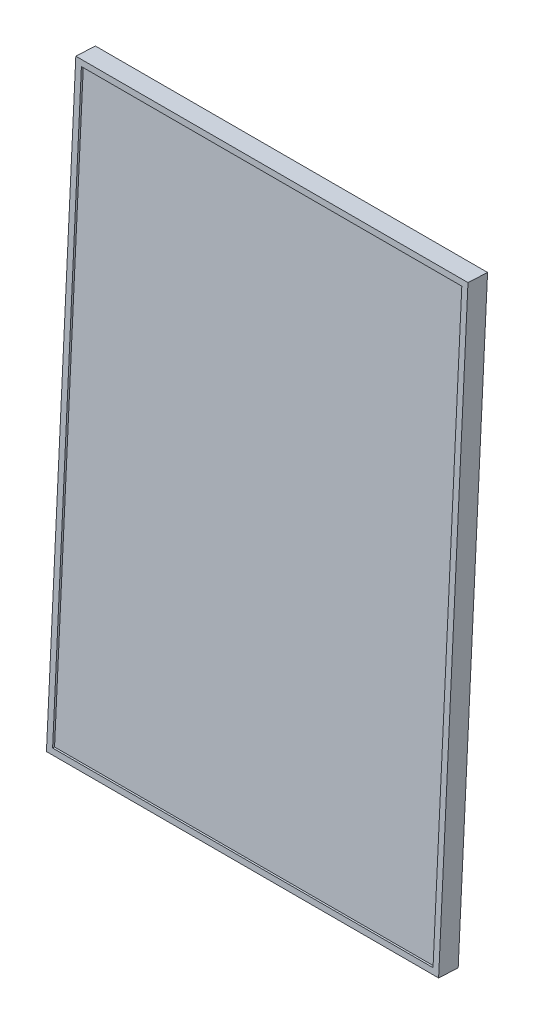
from build123d import *

# Parameters (mm, degrees)
BOSS_EXTRUDE1_DEPTH      = 5
BOSS_EXTRUDE1_DEPTH_BACK = 5
SKETCH2_W                = 200
SKETCH2_H                = 300
SKETCH4_W                = 194
SKETCH4_H                = 294
CUT_EXTRUDE1_DEPTH       = 1


with BuildPart() as part:
    # Sketch2 → Boss-Extrude1 (new, two sides: drawn at the far end of the back side and taken through both)
    with BuildSketch(Plane(origin=(0, 3.030412593, 60.608251865), x_dir=(1, 0, 0), z_dir=(0, 0.0499376169438969, 0.9987523388778444)).offset(-BOSS_EXTRUDE1_DEPTH_BACK)):
        with Locations((3.957252563, -135.75687777)):
            Rectangle(SKETCH2_W, SKETCH2_H)
    extrude(amount=BOSS_EXTRUDE1_DEPTH + BOSS_EXTRUDE1_DEPTH_BACK)

    # Sketch4 → Cut-Extrude1 (cut)
    with BuildSketch(Plane(origin=(0, 3.280100678, 65.60201356), x_dir=(1, 0, 0), z_dir=(0, 0.049937616943896895, 0.9987523388778444))):
        with Locations((3.957252563, -135.75687777)):
            Rectangle(SKETCH4_W, SKETCH4_H)
    extrude(amount=-CUT_EXTRUDE1_DEPTH, mode=Mode.SUBTRACT)


solid = part.part
